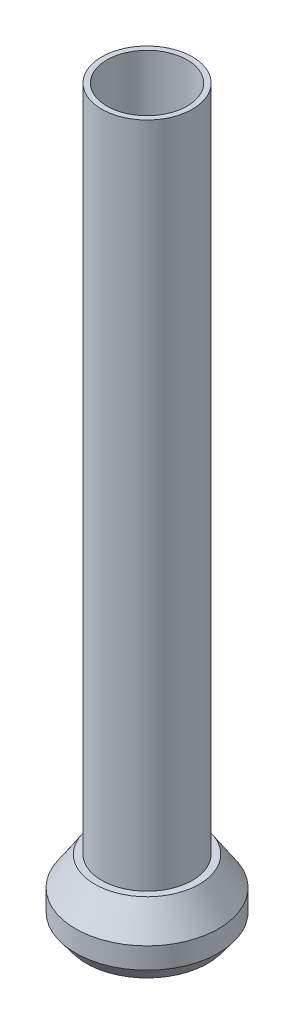
from build123d import *

# Parameters (mm, degrees)
SKETCH1_R           = 12.7
SKETCH1_R_2         = 11.227
BOSS_EXTRUDE1_DEPTH = 205


with BuildPart() as part:
    # Sketch1 → Boss-Extrude1 (new body)
    with BuildSketch(Plane(origin=(0, 0, 0), x_dir=(1, 0, 0), z_dir=(0, 1, 0))):
        with Locations(Location((0, 0, 0), (0, 0, 90))):
            Circle(SKETCH1_R)
        with Locations(Location((0, 0, 0), (0, 0, 90))):
            Circle(SKETCH1_R_2, mode=Mode.SUBTRACT)
    extrude(amount=BOSS_EXTRUDE1_DEPTH)

    # Sketch2 → Revolve1 (revolve)
    with BuildSketch(Plane.XY, mode=Mode.PRIVATE) as revolve1_sk:
        Polygon((0, 0), (17, 0), (20, 4), (20, 9.9), (14.605, 18), (0, 18), align=None)
    revolve(revolve1_sk.sketch.rotate(Axis((0, -10, 0), (0, 1, 0)), 90), axis=Axis((0, -10, 0), (0, 1, 0)))


solid = part.part
